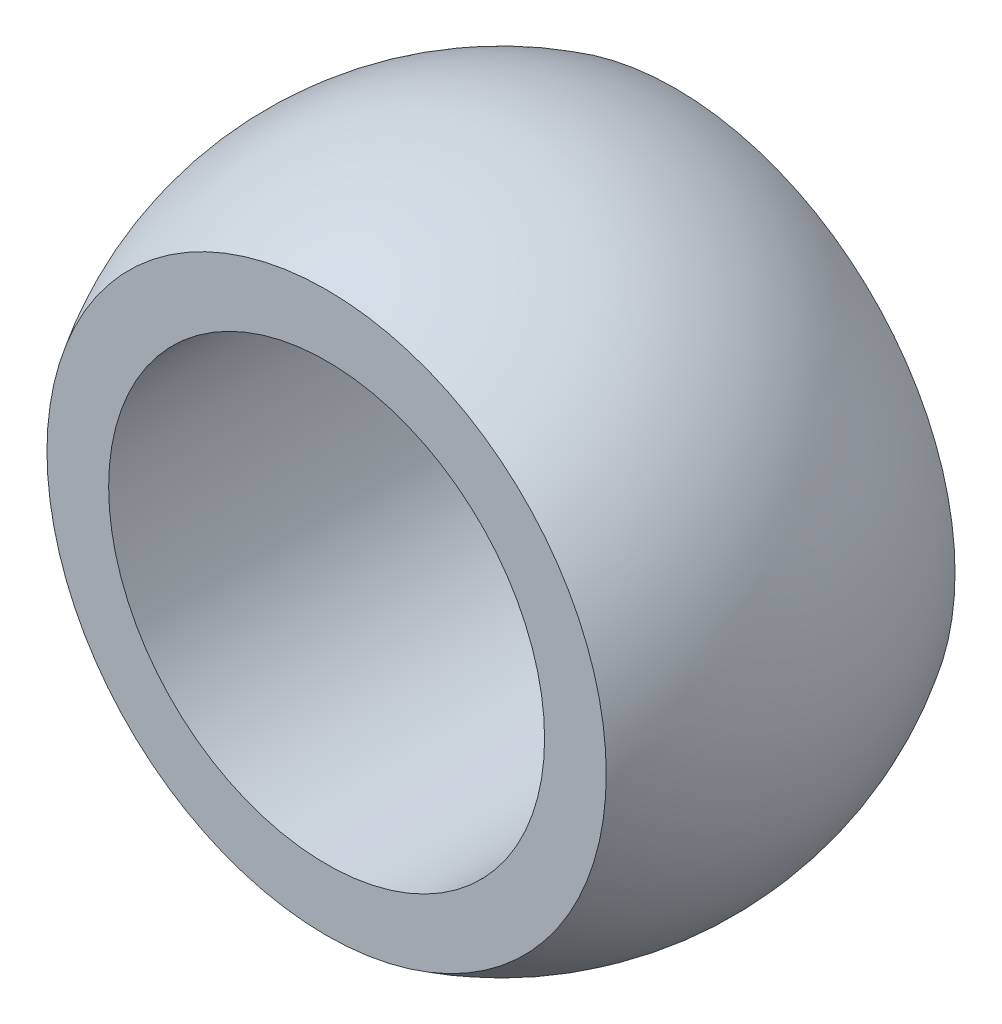
from build123d import *

# Parameters (mm, degrees)
CUT_EXTRUDE1_DEPTH      = 21.785008063
CUT_EXTRUDE1_DEPTH_BACK = 21.785008063
SKETCH3_R               = 7.9375
CUT_EXTRUDE3_DEPTH      = 22.196722391


with BuildPart() as part:
    # Sketch1 → Revolve1 (revolve)
    with BuildSketch(Plane(origin=(0, 0, 0), x_dir=(1, 0, 0), z_dir=(0, 1, 0))):
        with BuildLine():
            Line((0, 12.00023), (0, -12.00023))
            ThreePointArc((0, -12.00023), (12.00023, 0), (0, 12.00023))
        make_face()
    revolve(axis=Axis((0, 0, -16.515997735), (0, 0, 1)))

    # Sketch2 → Cut-Extrude1 (cut, two sides: drawn at the far end of the back side and taken through both)
    with BuildSketch(Plane(origin=(0, 0, 0), x_dir=(0, 0, -1), z_dir=(1, 0, 0)).offset(-CUT_EXTRUDE1_DEPTH_BACK)):
        with BuildLine():
            Line((-6.35, 10.182485947), (-6.35, -10.182485947))
            ThreePointArc((-6.35, -10.182485947), (-12.00023, 0), (-6.35, 10.182485947))
        make_face()
        with BuildLine():
            ThreePointArc((6.35, -10.182485947), (12.00023, 0), (6.35, 10.182485947))
            Line((6.35, 10.182485947), (6.35, -10.182485947))
        make_face()
    extrude(amount=CUT_EXTRUDE1_DEPTH + CUT_EXTRUDE1_DEPTH_BACK, mode=Mode.SUBTRACT)

    # Sketch3 → Cut-Extrude3 (cut, through all)
    with BuildSketch(Plane.XY.offset(6.35)):
        Circle(SKETCH3_R)
    extrude(amount=-CUT_EXTRUDE3_DEPTH, mode=Mode.SUBTRACT)


solid = part.part
